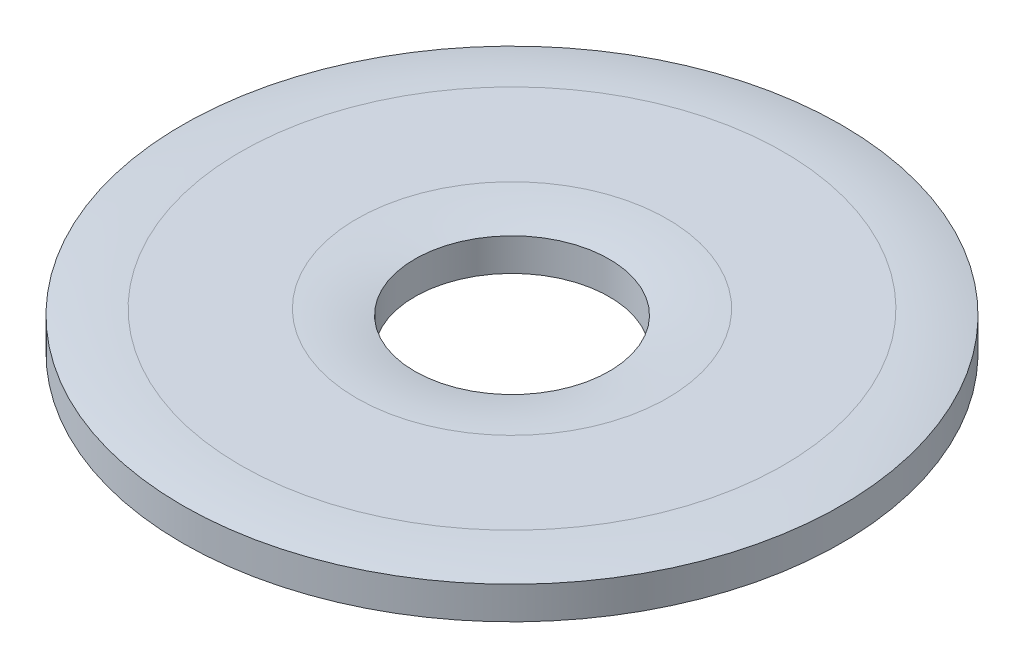
from build123d import *


with BuildPart() as part:
    # Sketch3 → Revolve1 (revolve)
    with BuildSketch(Plane(origin=(0, 0, 0), x_dir=(0, 0, -1), z_dir=(1, 0, 0)), mode=Mode.PRIVATE) as revolve1_sk:
        with BuildLine():
            Line((8.7376, -0.508), (2.5781, -0.508))
            Line((2.5781, -0.508), (2.5781, 0.3556))
            ThreePointArc((2.5781, 0.3556), (3.344275967, 0.469807158), (4.117975, 0.508))
            Line((4.117975, 0.508), (7.197725, 0.508))
            ThreePointArc((7.197725, 0.508), (7.971424033, 0.469807158), (8.7376, 0.3556))
            Line((8.7376, 0.3556), (8.7376, -0.508))
        make_face()
    revolve(revolve1_sk.sketch.rotate(Axis((0, 0.508, 0), (0, -1, 0)), 180), axis=Axis((0, 0.508, 0), (0, -1, 0)))


solid = part.part
